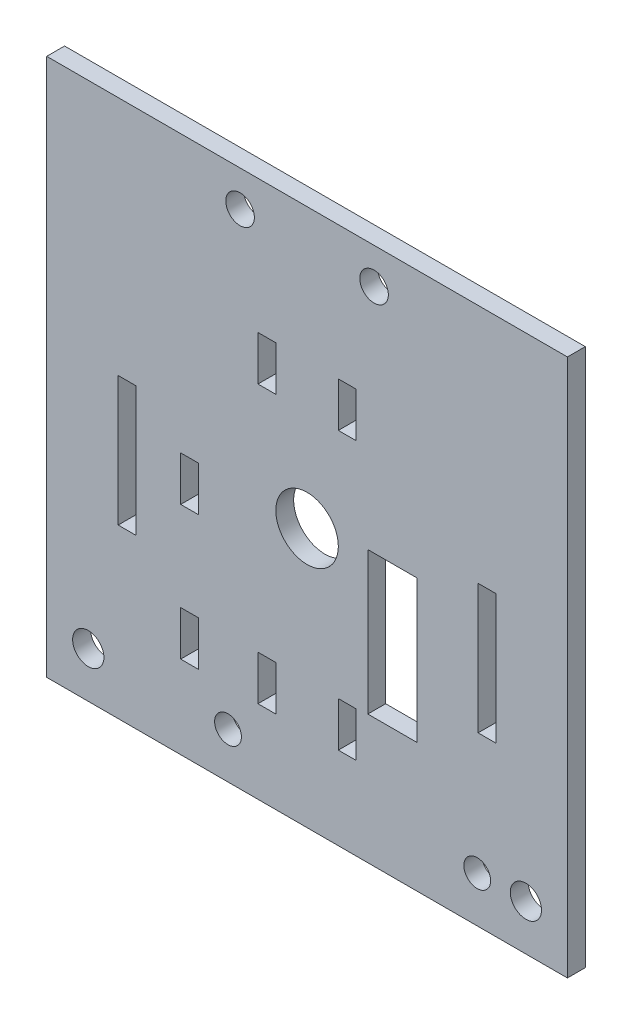
from build123d import *

# Parameters (mm, degrees)
SKETCH1_R           = 3.5
SKETCH1_R_2         = 1.5
SKETCH1_R_3         = 2.5
SKETCH1_W           = 2
SKETCH1_H           = 5
SKETCH1_W_2         = 5.5
SKETCH1_H_2         = 15.95
SKETCH1_H_3         = 14.5
BOSS_EXTRUDE1_DEPTH = 2
SKETCH_5_W          = 53.3
SKETCH_5_H          = 62.979589089
CUT_EXTRUDE_1_DEPTH = 10
SKETCH_6_R          = 1.75
CUT_EXTRUDE_2_DEPTH = 10
SKETCH_7_W          = 2
SKETCH_7_H          = 65.797700214
EXTRUDE_1_DEPTH     = 2.5
SKETCH_8_W          = 2
SKETCH_8_H          = 65.797700214
EXTRUDE_2_DEPTH     = 2.5
SKETCH_9_W          = 58.3
SKETCH_9_H          = 2
EXTRUDE_3_DEPTH     = 2
SKETCH_10_W         = 58.3
SKETCH_10_H         = 5
CUT_EXTRUDE_3_DEPTH = 10
SKETCH_13_W         = 58.3
SKETCH_13_H         = 2.577289
CUT_EXTRUDE_4_DEPTH = 10
SKETCH_14_R         = 1.6
CUT_EXTRUDE_5_DEPTH = 10


with BuildPart() as part:
    # Sketch1 → Boss-Extrude1 (new body)
    with BuildSketch(Plane.XY):
        with BuildLine():
            Line((-25.65, 0), (25.65, 0))
            ThreePointArc((25.65, 0), (26.357106781, 0.292893219), (26.65, 1))
            Line((26.65, 1), (26.65, 123.726079281))
            Line((26.65, 123.726079281), (26.65, 128.777289303))
            Line((26.65, 128.777289303), (-26.65, 128.777289303))
            Line((-26.65, 128.777289303), (-26.65, 99.754415082))
            Line((-26.65, 99.754415082), (-26.65, 1))
            ThreePointArc((-26.65, 1), (-26.357106781, 0.292893219), (-25.65, 0))
        make_face()
        with Locations((0, 90)):
            Circle(SKETCH1_R, mode=Mode.SUBTRACT)
        with Locations((19.05, 66.1)):
            Circle(SKETCH1_R_2, mode=Mode.SUBTRACT)
        with Locations((-8.85, 66.1)):
            Circle(SKETCH1_R_2, mode=Mode.SUBTRACT)
        with Locations((-24.05, 15.3)):
            Circle(SKETCH1_R_2, mode=Mode.SUBTRACT)
        with Locations((24.15, 14)):
            Circle(SKETCH1_R_2, mode=Mode.SUBTRACT)
        with Locations((0, 34.3)):
            Circle(SKETCH1_R_3, mode=Mode.SUBTRACT)
        with Locations((4.5, 103.75)):
            Rectangle(SKETCH1_W, SKETCH1_H, mode=Mode.SUBTRACT)
        with Locations((9.55, 83.375)):
            Rectangle(SKETCH1_W_2, SKETCH1_H_2, mode=Mode.SUBTRACT)
        with Locations((20.15, 87)):
            Rectangle(SKETCH1_W, SKETCH1_H_3, mode=Mode.SUBTRACT)
        with Locations((4.5, 72.75)):
            Rectangle(SKETCH1_W, SKETCH1_H, mode=Mode.SUBTRACT)
        with Locations((-4.5, 72.75)):
            Rectangle(SKETCH1_W, SKETCH1_H, mode=Mode.SUBTRACT)
        with Locations((-20.15, 87)):
            Rectangle(SKETCH1_W, SKETCH1_H_3, mode=Mode.SUBTRACT)
        with Locations((-4.5, 103.75)):
            Rectangle(SKETCH1_W, SKETCH1_H, mode=Mode.SUBTRACT)
        with Locations((-13.15, 72.75)):
            Rectangle(SKETCH1_W, SKETCH1_H, mode=Mode.SUBTRACT)
        with Locations((-13.15, 87.75)):
            Rectangle(SKETCH1_W, SKETCH1_H, mode=Mode.SUBTRACT)
        Polygon((-20, 34.3), (-20, 36.05), (-7, 36.05), (-7, 34.3), (-7, 32.55), (-20, 32.55), align=None, mode=Mode.SUBTRACT)
        Polygon((-5.232050808, 39.362177826), (-15.732050808, 57.548711306), (-12.267949192, 59.548711306), (-1.767949192, 41.362177826), align=None, mode=Mode.SUBTRACT)
        Polygon((1.767949192, 41.362177826), (5.232050808, 39.362177826), (15.732050808, 57.548711306), (12.267949192, 59.548711306), align=None, mode=Mode.SUBTRACT)
        Polygon((7, 34.3), (7, 32.55), (20, 32.55), (20, 34.3), (20, 36.05), (7, 36.05), align=None, mode=Mode.SUBTRACT)
        Polygon((-1.767949192, 27.237822174), (-5.232050808, 29.237822174), (-15.732050808, 11.051288694), (-12.267949192, 9.051288694), align=None, mode=Mode.SUBTRACT)
        Polygon((15.732050808, 11.051288694), (12.267949192, 9.051288694), (1.767949192, 27.237822174), (5.232050808, 29.237822174), align=None, mode=Mode.SUBTRACT)
    extrude(amount=BOSS_EXTRUDE1_DEPTH)

    # 草图5 → 切除-拉伸1 (cut)
    with BuildSketch(Plane(origin=(0, 0, 0), x_dir=(-1, 0, 0), z_dir=(0, 0, -1))):
        with Locations((0, 31.489794545)):
            Rectangle(SKETCH_5_W, SKETCH_5_H)
    extrude(amount=-CUT_EXTRUDE_1_DEPTH, mode=Mode.SUBTRACT)

    # 草图6 → 切除-拉伸2 (cut)
    with BuildSketch(Plane.XY.offset(2)):
        with Locations((-24.5, 66.1)):
            Circle(SKETCH_6_R)
        with Locations((24.5, 66.1)):
            Circle(SKETCH_6_R)
    extrude(amount=-CUT_EXTRUDE_2_DEPTH, mode=Mode.SUBTRACT)

    # 草图7 → 凸台-拉伸1 (add)
    with BuildSketch(Plane(origin=(26.65, 0, 0), x_dir=(0, 0, -1), z_dir=(1, 0, 0))):
        with Locations((-1, 95.878439196)):
            Rectangle(SKETCH_7_W, SKETCH_7_H)
    extrude(amount=EXTRUDE_1_DEPTH)

    # 草图8 → 凸台-拉伸2 (add)
    with BuildSketch(Plane.ZY.offset(26.65)):
        with Locations((1, 95.878439196)):
            Rectangle(SKETCH_8_W, SKETCH_8_H)
    extrude(amount=EXTRUDE_2_DEPTH)

    # 草图9 → 凸台-拉伸3 (add)
    with BuildSketch(Plane.XZ.offset(-62.979589089)):
        with Locations((0, 1)):
            Rectangle(SKETCH_9_W, SKETCH_9_H)
    extrude(amount=EXTRUDE_3_DEPTH)

    # 草图10 → 切除-拉伸3 (cut)
    with BuildSketch(Plane.XY.offset(2)):
        with Locations((0, 126.277289303)):
            Rectangle(SKETCH_10_W, SKETCH_10_H)
    extrude(amount=-CUT_EXTRUDE_3_DEPTH, mode=Mode.SUBTRACT)

    # 草图13 → 切除-拉伸4 (cut)
    with BuildSketch(Plane.XY.offset(2)):
        with Locations((0, 122.488644803)):
            Rectangle(SKETCH_13_W, SKETCH_13_H)
    extrude(amount=-CUT_EXTRUDE_4_DEPTH, mode=Mode.SUBTRACT)

    # 草图14 → 切除-拉伸5 (cut)
    with BuildSketch(Plane.XY.offset(2)):
        with Locations((-7.5, 117.200000303)):
            Circle(SKETCH_14_R)
        with Locations((7.5, 117.200000303)):
            Circle(SKETCH_14_R)
    extrude(amount=-CUT_EXTRUDE_5_DEPTH, mode=Mode.SUBTRACT)


solid = part.part
